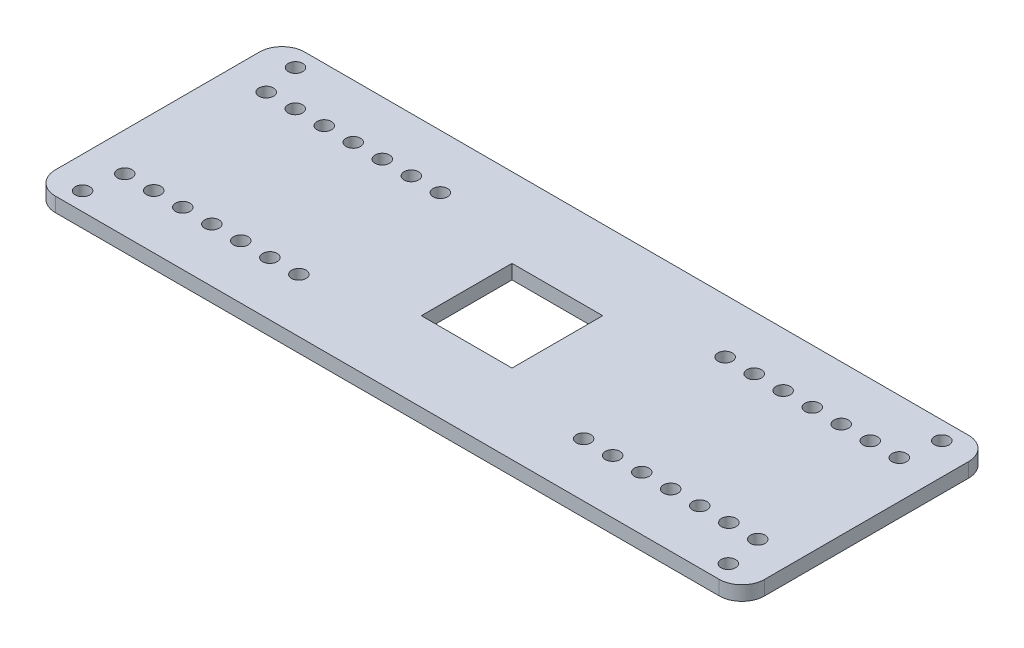
from build123d import *

# Parameters (mm, degrees)
SKETCH2_W           = 156.4
SKETCH2_H           = 55
BOSS_EXTRUDE1_DEPTH = 3.175
SKETCH5_R           = 1.6
CUT_EXTRUDE3_DEPTH  = 83.955232656
SKETCH6_R           = 1.6
CUT_EXTRUDE4_DEPTH  = 83.955232656
SKETCH7_W           = 20
SKETCH7_H           = 20
CUT_EXTRUDE5_DEPTH  = 83.955232656
FILLET1_R           = 5


with BuildPart() as part:
    # Sketch2 → Boss-Extrude1 (new body)
    with BuildSketch(Plane(origin=(0, 0, 0), x_dir=(1, 0, 0), z_dir=(0, 1, 0))):
        Rectangle(SKETCH2_W, SKETCH2_H)
    extrude(amount=BOSS_EXTRUDE1_DEPTH)

    # Sketch5 → Cut-Extrude3 (cut, through all)
    with BuildSketch(Plane(origin=(0, 3.175, 0), x_dir=(1, 0, 0), z_dir=(0, 1, 0))):
        with Locations(Location((-71.2, -23.5, 0), (0, 0, 270))):
            Circle(SKETCH5_R)
        with Locations(Location((-71.258884374, 23.517459766, 0), (0, 0, 90))):
            Circle(SKETCH5_R)
        with Locations(Location((71.258884374, 23.517459766, 0), (0, 0, 270))):
            Circle(SKETCH5_R)
        with Locations(Location((71.2, -23.5, 0), (0, 0, 90))):
            Circle(SKETCH5_R)
    extrude(amount=-CUT_EXTRUDE3_DEPTH, mode=Mode.SUBTRACT)

    # Sketch6 → Cut-Extrude4 (cut, through all)
    with BuildSketch(Plane(origin=(0, 3.175, 0), x_dir=(1, 0, 0), z_dir=(0, 1, 0))):
        with Locations(Location((69.8, -15.6, 0), (0, 0, 270))):
            Circle(SKETCH6_R)
        with Locations(Location((63.4, -15.6, 0), (0, 0, 270))):
            Circle(SKETCH6_R)
        with Locations(Location((57, -15.6, 0), (0, 0, 270))):
            Circle(SKETCH6_R)
        with Locations(Location((50.6, -15.6, 0), (0, 0, 270))):
            Circle(SKETCH6_R)
        with Locations(Location((37.8, -15.6, 0), (0, 0, 270))):
            Circle(SKETCH6_R)
        with Locations(Location((31.4, -15.6, 0), (0, 0, 270))):
            Circle(SKETCH6_R)
        with Locations(Location((44.2, -15.6, 0), (0, 0, 270))):
            Circle(SKETCH6_R)
        with Locations(Location((31.4, 15.6, 0), (0, 0, 90))):
            Circle(SKETCH6_R)
        with Locations(Location((37.8, 15.6, 0), (0, 0, 90))):
            Circle(SKETCH6_R)
        with Locations(Location((44.2, 15.6, 0), (0, 0, 90))):
            Circle(SKETCH6_R)
        with Locations(Location((50.6, 15.6, 0), (0, 0, 90))):
            Circle(SKETCH6_R)
        with Locations(Location((57, 15.6, 0), (0, 0, 90))):
            Circle(SKETCH6_R)
        with Locations(Location((63.4, 15.6, 0), (0, 0, 90))):
            Circle(SKETCH6_R)
        with Locations(Location((69.8, 15.6, 0), (0, 0, 90))):
            Circle(SKETCH6_R)
        with Locations(Location((-31.4, 15.6, 0), (0, 0, 270))):
            Circle(SKETCH6_R)
        with Locations(Location((-37.8, 15.6, 0), (0, 0, 270))):
            Circle(SKETCH6_R)
        with Locations(Location((-44.2, 15.6, 0), (0, 0, 270))):
            Circle(SKETCH6_R)
        with Locations(Location((-50.6, 15.6, 0), (0, 0, 270))):
            Circle(SKETCH6_R)
        with Locations(Location((-57, 15.6, 0), (0, 0, 270))):
            Circle(SKETCH6_R)
        with Locations(Location((-63.4, 15.6, 0), (0, 0, 270))):
            Circle(SKETCH6_R)
        with Locations(Location((-69.8, 15.6, 0), (0, 0, 270))):
            Circle(SKETCH6_R)
        with Locations(Location((-31.4, -15.6, 0), (0, 0, 90))):
            Circle(SKETCH6_R)
        with Locations(Location((-37.8, -15.6, 0), (0, 0, 90))):
            Circle(SKETCH6_R)
        with Locations(Location((-44.2, -15.6, 0), (0, 0, 90))):
            Circle(SKETCH6_R)
        with Locations(Location((-50.6, -15.6, 0), (0, 0, 90))):
            Circle(SKETCH6_R)
        with Locations(Location((-57, -15.6, 0), (0, 0, 90))):
            Circle(SKETCH6_R)
        with Locations(Location((-63.4, -15.6, 0), (0, 0, 90))):
            Circle(SKETCH6_R)
        with Locations(Location((-69.8, -15.6, 0), (0, 0, 90))):
            Circle(SKETCH6_R)
    extrude(amount=-CUT_EXTRUDE4_DEPTH, mode=Mode.SUBTRACT)

    # Sketch7 → Cut-Extrude5 (cut, through all)
    with BuildSketch(Plane(origin=(0, 3.175, 0), x_dir=(1, 0, 0), z_dir=(0, 1, 0))):
        Rectangle(SKETCH7_W, SKETCH7_H)
    extrude(amount=-CUT_EXTRUDE5_DEPTH, mode=Mode.SUBTRACT)

    # Fillet1
    fillet1_edges = [part.edges().sort_by_distance(p)[0] for p in [
        (78.2, 1.5875, 27.5),
        (-78.2, 1.5875, 27.5),
        (-78.2, 1.5875, -27.5),
        (78.2, 1.5875, -27.5),
    ]]
    fillet(fillet1_edges, radius=FILLET1_R)


solid = part.part
